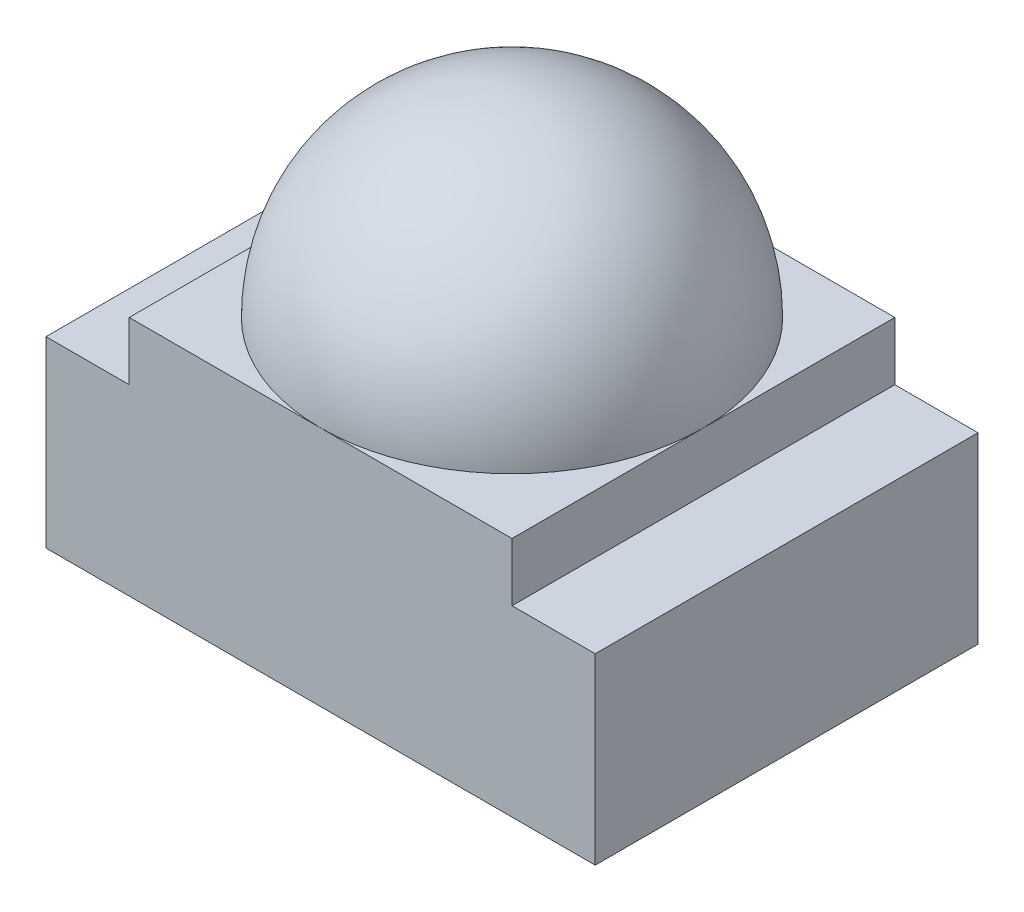
from build123d import *

# Parameters (mm, degrees)
BOSS_EXTRUDE1_DEPTH      = 1
BOSS_EXTRUDE1_DEPTH_BACK = 10
SKETCH1_W                = 33
SKETCH1_H                = 23
SKETCH2_W                = 23
SKETCH2_H                = 23
BOSS_EXTRUDE2_DEPTH      = 3.5


with BuildPart() as part:
    # Sketch1 → Boss-Extrude1 (new, two sides: drawn at the far end of the back side and taken through both)
    with BuildSketch(Plane(origin=(0, 0, 0), x_dir=(1, 0, 0), z_dir=(0, 1, 0)).offset(-BOSS_EXTRUDE1_DEPTH_BACK)):
        Rectangle(SKETCH1_W, SKETCH1_H)
    extrude(amount=BOSS_EXTRUDE1_DEPTH + BOSS_EXTRUDE1_DEPTH_BACK)

    # Sketch2 → Boss-Extrude2 (add)
    with BuildSketch(Plane(origin=(0, 1, 0), x_dir=(1, 0, 0), z_dir=(0, 1, 0))):
        Rectangle(SKETCH2_W, SKETCH2_H)
    extrude(amount=BOSS_EXTRUDE2_DEPTH)

    # Sketch3 → Revolve1 (revolve)
    with BuildSketch(Plane.XY):
        with BuildLine():
            Line((0, 4.5), (11.5, 4.5))
            ThreePointArc((11.5, 4.5), (8.131727984, 12.631727984), (0, 16))
            Line((0, 16), (0, 4.5))
        make_face()
    revolve(axis=Axis((0, 16, 0), (0, -1, 0)))


solid = part.part
